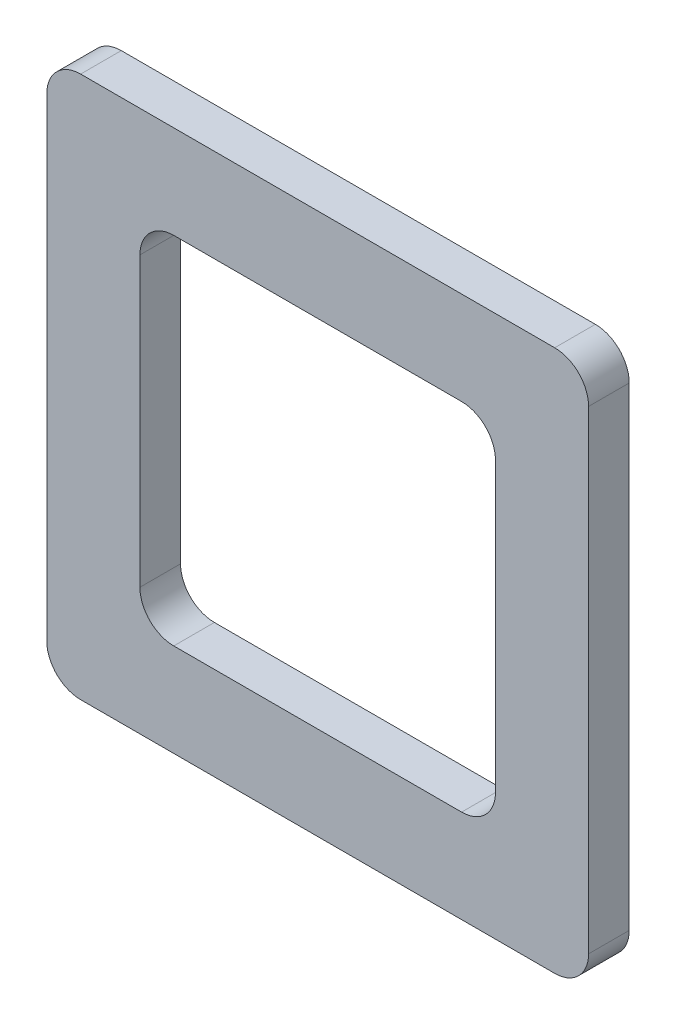
from build123d import *

# Parameters (mm, degrees)
EXTRUDE1_DEPTH     = 12
CUT_EXTRUDE1_DEPTH = 227.592144612


with BuildPart() as part:
    # Sketch1 → Extrude1 (new body)
    with BuildSketch(Plane.XY):
        with BuildLine():
            Line((10, 0), (150, 0))
            ThreePointArc((150, 0), (157.071067812, 2.928932188), (160, 10))
            Line((160, 10), (160, 150))
            ThreePointArc((160, 150), (157.071067812, 157.071067812), (150, 160))
            Line((150, 160), (10, 160))
            ThreePointArc((10, 160), (2.928932188, 157.071067812), (0, 150))
            Line((0, 150), (0, 10))
            ThreePointArc((0, 10), (2.928932188, 2.928932188), (10, 0))
        make_face()
    extrude(amount=EXTRUDE1_DEPTH)

    # Sketch2 → Cut-Extrude1 (cut, through all)
    with BuildSketch(Plane.XY.offset(12)):
        with BuildLine():
            Line((27.5, 122.5), (27.5, 37.5))
            ThreePointArc((27.5, 37.5), (30.428932188, 30.428932188), (37.5, 27.5))
            Line((37.5, 27.5), (122.5, 27.5))
            ThreePointArc((122.5, 27.5), (129.571067812, 30.428932188), (132.5, 37.5))
            Line((132.5, 37.5), (132.5, 122.5))
            ThreePointArc((132.5, 122.5), (129.571067812, 129.571067812), (122.5, 132.5))
            Line((122.5, 132.5), (37.5, 132.5))
            ThreePointArc((37.5, 132.5), (30.428932188, 129.571067812), (27.5, 122.5))
        make_face()
    extrude(amount=-CUT_EXTRUDE1_DEPTH, mode=Mode.SUBTRACT)


solid = part.part
